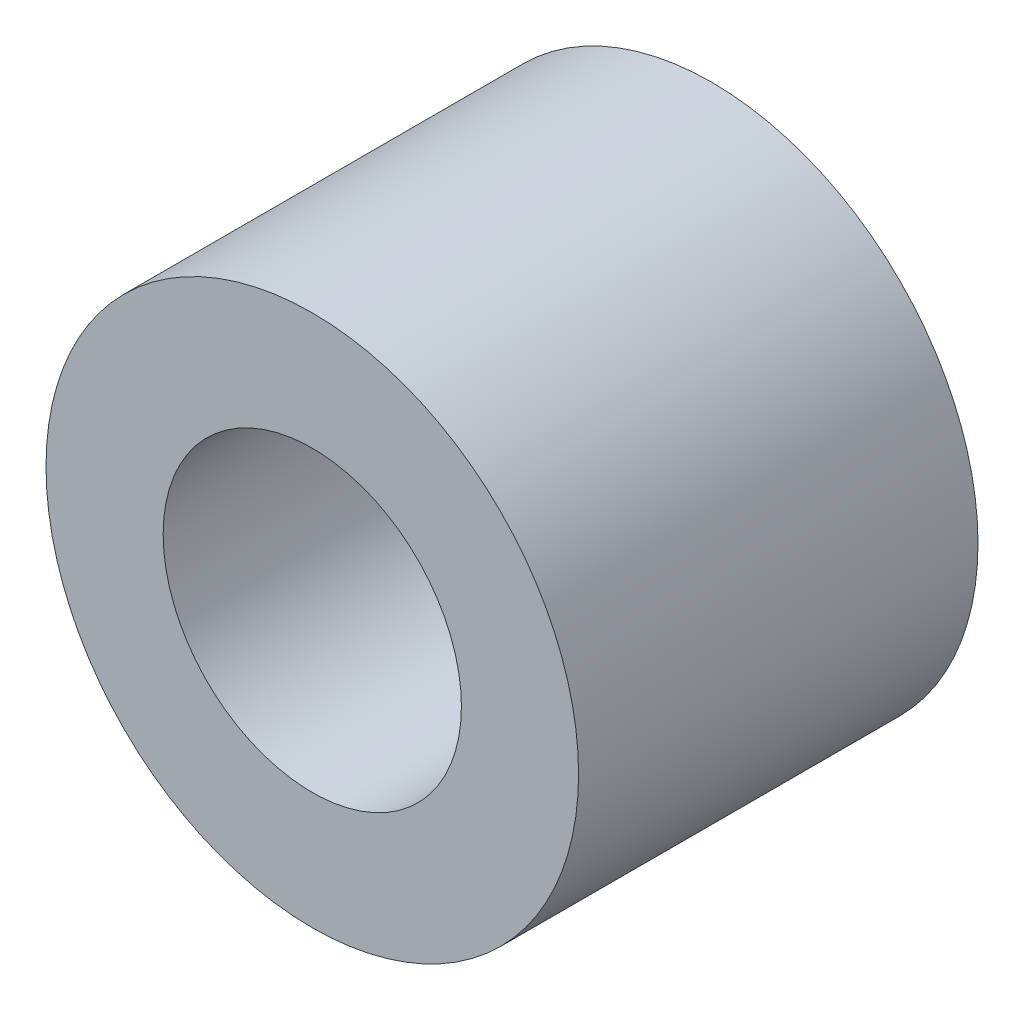
from build123d import *

# Parameters (mm, degrees)
SKETCH1_R      = 3.175
SKETCH1_R_2    = 1.778
EXTRUDE1_DEPTH = 2.38125


with BuildPart() as part:
    # Sketch1 → Extrude1 (new, symmetric)
    with BuildSketch(Plane.XY):
        with Locations(Location((0, 0, 0), (0, 0, 180))):
            Circle(SKETCH1_R)
        with Locations(Location((0, 0, 0), (0, 0, 180))):
            Circle(SKETCH1_R_2, mode=Mode.SUBTRACT)
    extrude(amount=EXTRUDE1_DEPTH, both=True)


solid = part.part
